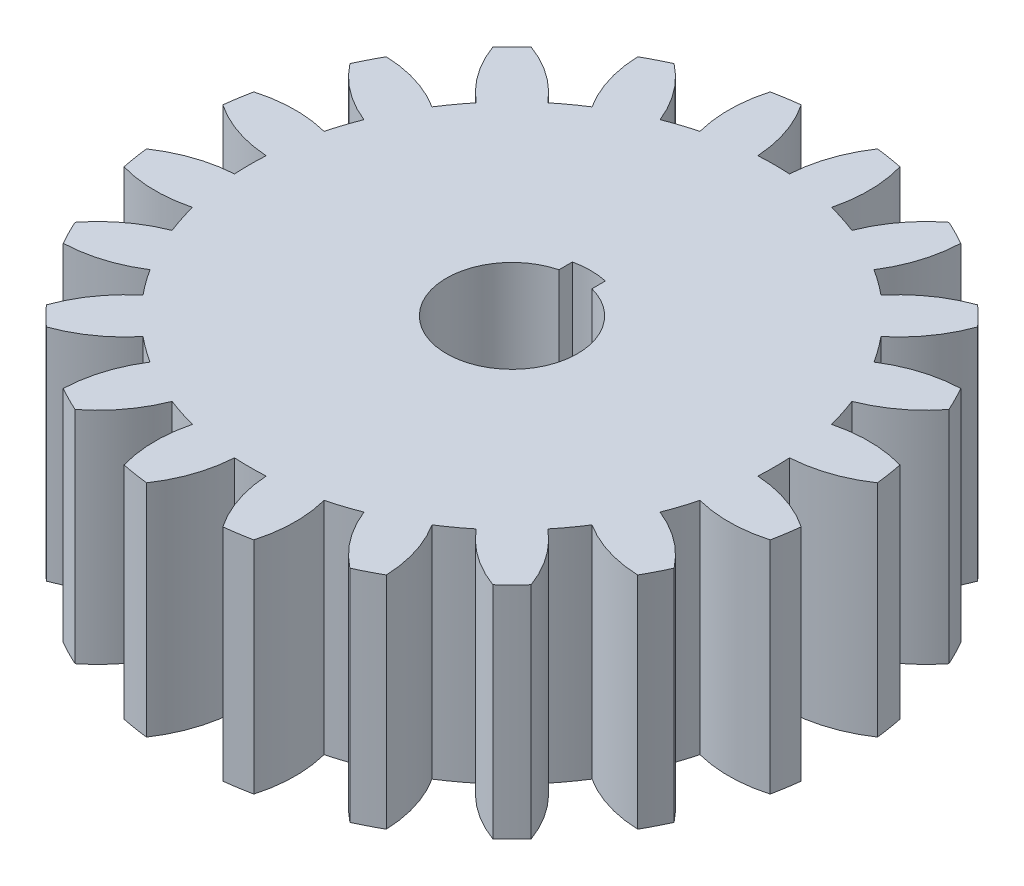
from build123d import *

# Parameters (mm, degrees)
IZIM4_R                     = 55
Y_KSEKLIK_EKSTR_ZYON1_DEPTH = 18.375
KES_EKSTR_ZYON2_DEPTH       = 25
DAIRESEL_KAPLAMA2_COUNT     = 20
KES_EKSTR_ZYON3_DEPTH       = 36.75


with BuildPart() as part:
    # Çizim4 → Yükseklik-Ekstrüzyon1 (new, symmetric)
    with BuildSketch(Plane(origin=(0, 0, 0), x_dir=(1, 0, 0), z_dir=(0, 1, 0))):
        with Locations(Location((0, 0, 0), (0, 0, 270))):
            Circle(IZIM4_R)
    extrude(amount=Y_KSEKLIK_EKSTR_ZYON1_DEPTH, both=True)

    # Çizim2 → Kes-Ekstrüzyon2 (cut, symmetric)
    with BuildSketch(Plane(origin=(0, 0, 0), x_dir=(1, 0, 0), z_dir=(0, 1, 0))):
        with BuildLine():
            ThreePointArc((6.364657179, 54.630496419), (0, 55), (-6.364657179, 54.630496419))
            ThreePointArc((-6.364657179, 54.630496419), (-3.766285823, 49.400564339), (-2.640650949, 43.670235431))
            ThreePointArc((-2.640650949, 43.670235431), (0, 43.75), (2.640650949, 43.670235431))
            ThreePointArc((2.640650949, 43.670235431), (3.766285823, 49.400564339), (6.364657179, 54.630496419))
        make_face()
    kes_ekstr_zyon2 = extrude(amount=KES_EKSTR_ZYON2_DEPTH, both=True, mode=Mode.SUBTRACT)

    # Dairesel Kaplama2: Kes-Ekstrüzyon2 ×20 about axis
    dairesel_kaplama2_axis = Axis((0, 0, 0), (0, 1, 0))
    for i in range(1, DAIRESEL_KAPLAMA2_COUNT):
        add(kes_ekstr_zyon2.rotate(dairesel_kaplama2_axis, i * 360 / DAIRESEL_KAPLAMA2_COUNT), mode=Mode.SUBTRACT)

    # Çizim9 → Kes-Ekstrüzyon3 (cut)
    with BuildSketch(Plane(origin=(0, 18.375, 0), x_dir=(1, 0, 0), z_dir=(0, 1, 0))):
        with BuildLine():
            Line((2.75, 10.58614218), (2.75, 12.833671532))
            ThreePointArc((2.75, 12.833671532), (0, 13.125), (-2.75, 12.833671532))
            Line((-2.75, 12.833671532), (-2.75, 10.58614218))
            ThreePointArc((-2.75, 10.58614218), (0, -10.9375), (2.75, 10.58614218))
        make_face()
    extrude(amount=-KES_EKSTR_ZYON3_DEPTH, mode=Mode.SUBTRACT)


solid = part.part
